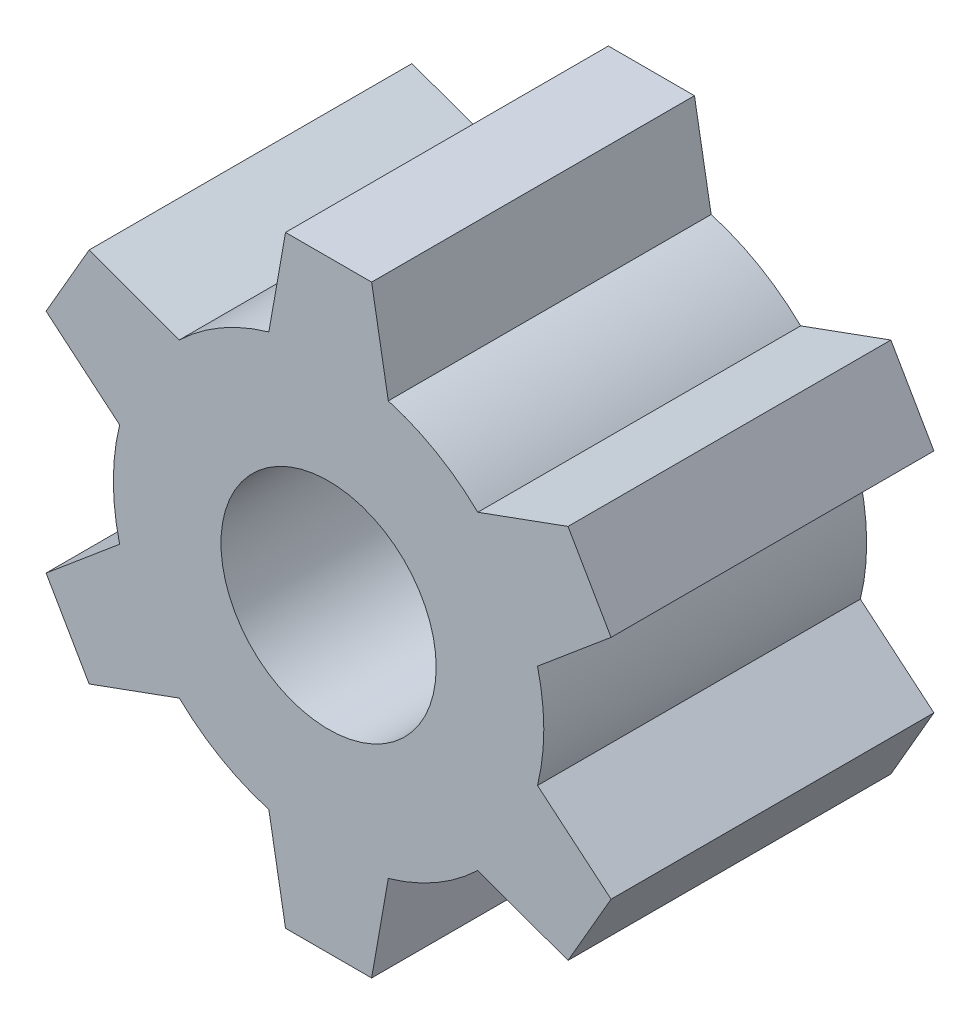
from build123d import *

# Parameters (mm, degrees)
CROQUIS1_R              = 2.5
SALIENTE_EXTRUIR5_DEPTH = 7.5


with BuildPart() as part:
    # Croquis1 → Saliente-Extruir5 (new body)
    with BuildSketch(Plane.XY):
        with BuildLine():
            Line((-1, 7), (1, 7))
            Line((1, 7), (1.387053768, 4.803757055))
            ThreePointArc((1.387053768, 4.803757055), (2.5, 4.330127019), (3.466648759, 3.603102327))
            Line((3.466648759, 3.603102327), (5.562177826, 4.366025404))
            Line((5.562177826, 4.366025404), (6.562177826, 2.633974596))
            Line((6.562177826, 2.633974596), (4.853702527, 1.200654728))
            ThreePointArc((4.853702527, 1.200654728), (5, 0), (4.853702527, -1.200654728))
            Line((4.853702527, -1.200654728), (6.562177826, -2.633974596))
            Line((6.562177826, -2.633974596), (5.562177826, -4.366025404))
            Line((5.562177826, -4.366025404), (3.466648759, -3.603102327))
            ThreePointArc((3.466648759, -3.603102327), (2.5, -4.330127019), (1.387053768, -4.803757055))
            Line((1.387053768, -4.803757055), (1, -7))
            Line((1, -7), (-1, -7))
            Line((-1, -7), (-1.387053768, -4.803757055))
            ThreePointArc((-1.387053768, -4.803757055), (-2.5, -4.330127019), (-3.466648759, -3.603102327))
            Line((-3.466648759, -3.603102327), (-5.562177826, -4.366025404))
            Line((-5.562177826, -4.366025404), (-6.562177826, -2.633974596))
            Line((-6.562177826, -2.633974596), (-4.853702527, -1.200654728))
            ThreePointArc((-4.853702527, -1.200654728), (-5, 0), (-4.853702527, 1.200654728))
            Line((-4.853702527, 1.200654728), (-6.562177826, 2.633974596))
            Line((-6.562177826, 2.633974596), (-5.562177826, 4.366025404))
            Line((-5.562177826, 4.366025404), (-3.466648759, 3.603102327))
            ThreePointArc((-3.466648759, 3.603102327), (-2.5, 4.330127019), (-1.387053768, 4.803757055))
            Line((-1.387053768, 4.803757055), (-1, 7))
        make_face()
        Circle(CROQUIS1_R, mode=Mode.SUBTRACT)
    extrude(amount=SALIENTE_EXTRUIR5_DEPTH)


solid = part.part
